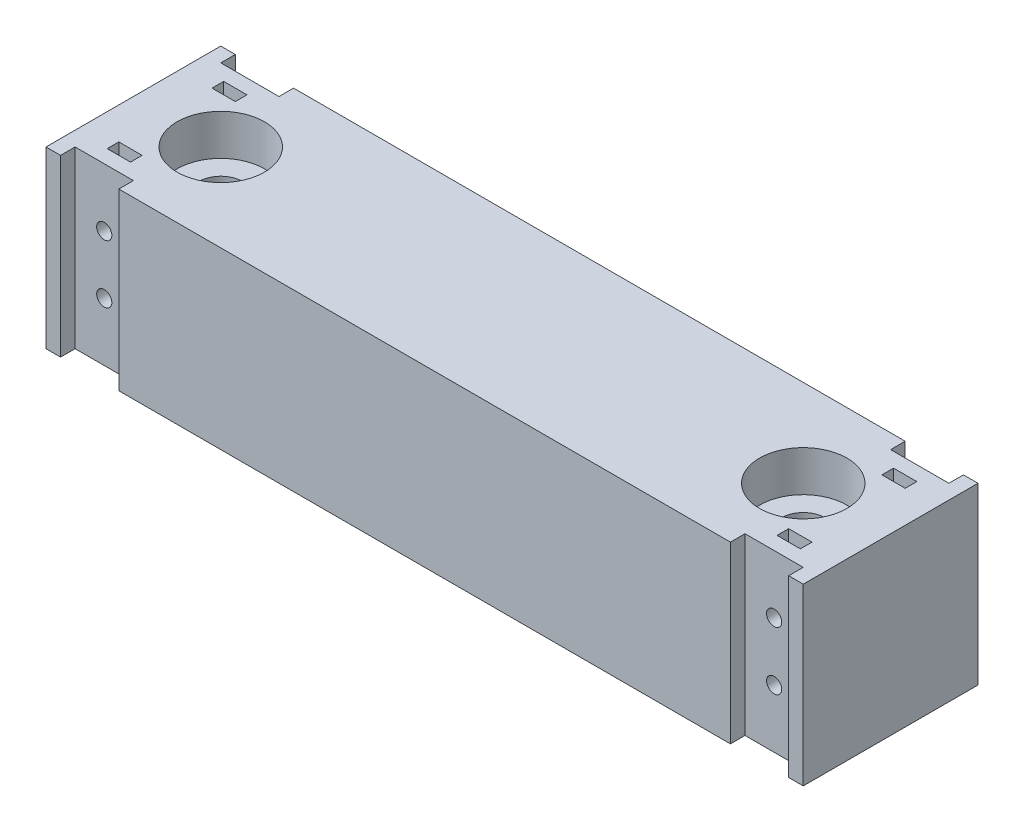
from build123d import *

# Parameters (mm, degrees)
SKETCH1_W               = 60
SKETCH1_H               = 60
BOSS_EXTRUDE1_DEPTH     = 260
CUT_EXTRUDE1_DEPTH      = 274.495886624
CUT_EXTRUDE1_DEPTH_BACK = 274.495886624
SKETCH2_R               = 7.5
CUT_EXTRUDE2_START      = 60
SKETCH3_R               = 15
CUT_EXTRUDE2_DEPTH      = 14
SKETCH4_W               = 20
SKETCH4_H               = 60
CUT_EXTRUDE3_DEPTH      = 5
CUT_EXTRUDE4_DEPTH      = 274.495886624
CUT_EXTRUDE4_DEPTH_BACK = 274.495886624
SKETCH5_R               = 2.6
CUT_EXTRUDE5_START      = -10
CUT_EXTRUDE5_DEPTH      = 4


with BuildPart() as part:
    # Sketch1 → Boss-Extrude1 (new body)
    with BuildSketch(Plane(origin=(0, 0, 0), x_dir=(0, 0, -1), z_dir=(1, 0, 0))):
        with Locations((30, 30)):
            Rectangle(SKETCH1_W, SKETCH1_H)
    extrude(amount=BOSS_EXTRUDE1_DEPTH)

    # Sketch2 → Cut-Extrude1 (cut, two sides: drawn at the far end of the back side and taken through both)
    with BuildSketch(Plane(origin=(0, 0, 0), x_dir=(1, 0, 0), z_dir=(0, 1, 0)).offset(-CUT_EXTRUDE1_DEPTH_BACK)):
        with Locations(Location((30, 30, 0), (0, 0, 270))):
            Circle(SKETCH2_R)
        with Locations(Location((230, 30, 0), (0, 0, 270))):
            Circle(SKETCH2_R)
    extrude(amount=CUT_EXTRUDE1_DEPTH + CUT_EXTRUDE1_DEPTH_BACK, mode=Mode.SUBTRACT)

    # Sketch3 → Cut-Extrude2 (cut)
    with BuildSketch(Plane(origin=(0, 0, 0), x_dir=(1, 0, 0), z_dir=(0, 1, 0)).offset(CUT_EXTRUDE2_START)):
        with Locations(Location((30, 30, 0), (0, 0, 90))):
            Circle(SKETCH3_R)
        with Locations(Location((230, 30, 0), (0, 0, 90))):
            Circle(SKETCH3_R)
    extrude(amount=-CUT_EXTRUDE2_DEPTH, mode=Mode.SUBTRACT)

    # Sketch4 → Cut-Extrude3 (cut)
    with BuildSketch(Plane.XY):
        with Locations((15, 30)):
            Rectangle(SKETCH4_W, SKETCH4_H)
        with Locations((245, 30)):
            Rectangle(SKETCH4_W, SKETCH4_H)
    cut_extrude3 = extrude(amount=-CUT_EXTRUDE3_DEPTH, mode=Mode.SUBTRACT)

    # Sketch5 → Cut-Extrude4 (cut, two sides: drawn at the far end of the back side and taken through both)
    with BuildSketch(Plane.XY.offset(-CUT_EXTRUDE4_DEPTH_BACK)):
        with Locations((15, 20)):
            Circle(SKETCH5_R)
        with Locations((15, 40)):
            Circle(SKETCH5_R)
        with Locations((245, 40)):
            Circle(SKETCH5_R)
        with Locations((245, 20)):
            Circle(SKETCH5_R)
    extrude(amount=CUT_EXTRUDE4_DEPTH + CUT_EXTRUDE4_DEPTH_BACK, mode=Mode.SUBTRACT)

    # Mirror2: Cut-Extrude3 across plane
    add(cut_extrude3.mirror(Plane.XY.offset(-30)), mode=Mode.SUBTRACT)

    # Sketch6 → Cut-Extrude5 (cut)
    with BuildSketch(Plane.XY.offset(CUT_EXTRUDE5_START)):
        Polygon((11, 20), (11, 0), (19, 0), (19, 20), (17, 23.464101615), (13, 23.464101615), align=None)
        Polygon((19, 60), (19, 40), (17, 36.535898385), (13, 36.535898385), (11, 40), (11, 60), align=None)
        Polygon((249, 40), (249, 60), (241, 60), (241, 40), (243, 36.535898385), (247, 36.535898385), align=None)
        Polygon((241, 0), (241, 20), (243, 23.464101615), (247, 23.464101615), (249, 20), (249, 0), align=None)
    cut_extrude5 = extrude(amount=-CUT_EXTRUDE5_DEPTH, mode=Mode.SUBTRACT)

    # Mirror3: Cut-Extrude5 across plane
    add(cut_extrude5.mirror(Plane.XY.offset(-30)), mode=Mode.SUBTRACT)


solid = part.part
